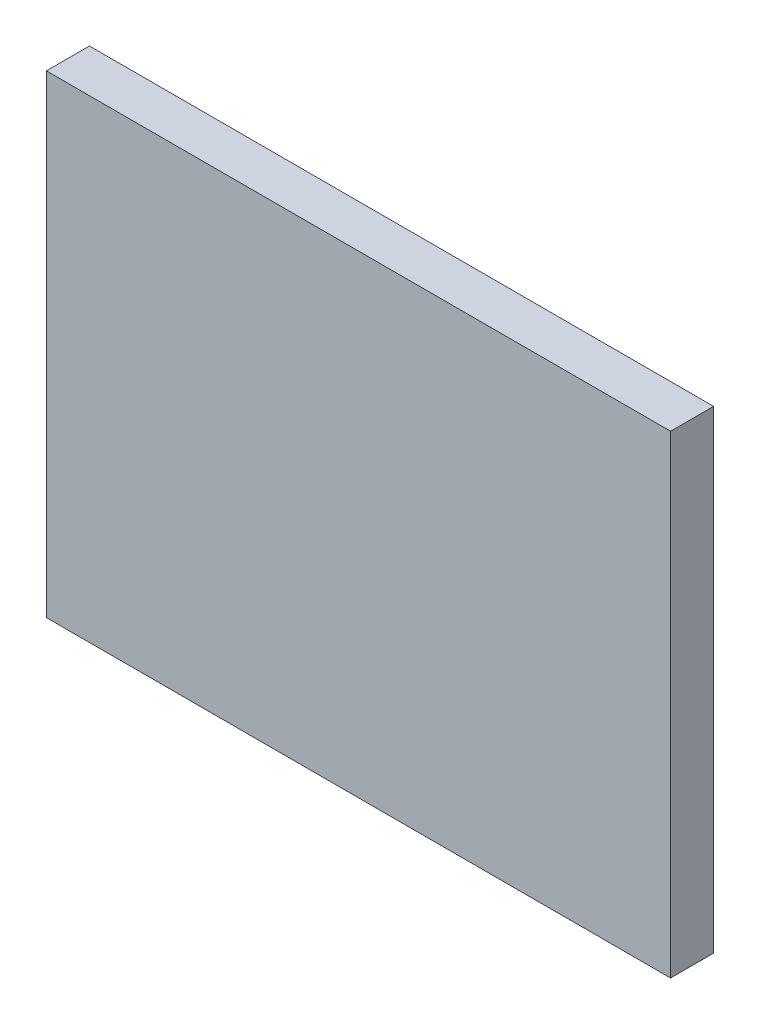
from build123d import *

# Parameters (mm, degrees)
SKETCH1_W           = 145
SKETCH1_H           = 110
BOSS_EXTRUDE2_DEPTH = 10


with BuildPart() as part:
    # Sketch1 → Boss-Extrude2 (new body)
    with BuildSketch(Plane.XY):
        Rectangle(SKETCH1_W, SKETCH1_H)
    extrude(amount=BOSS_EXTRUDE2_DEPTH)


solid = part.part
